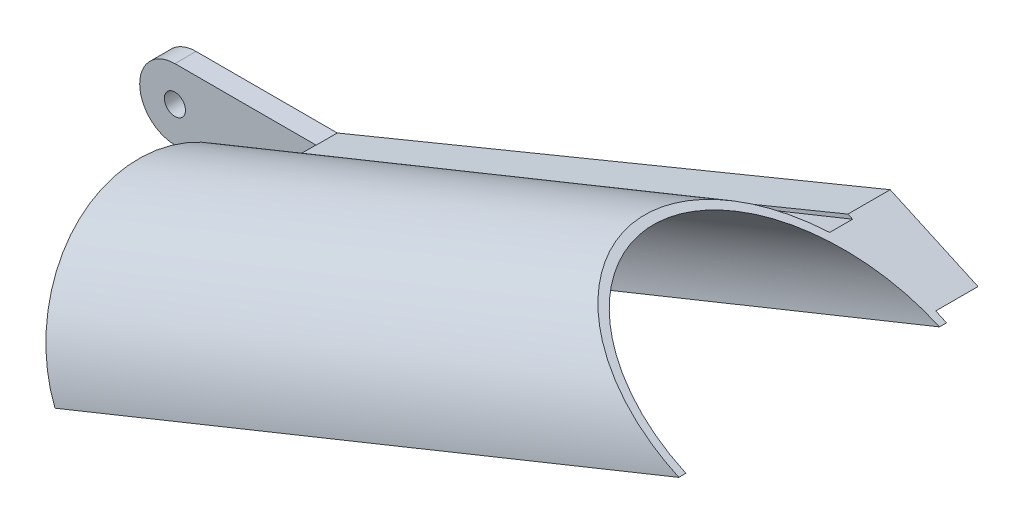
from build123d import *

# Parameters (mm, degrees)
SKETCH1_R           = 1.5
BOSS_EXTRUDE1_DEPTH = 3
EXTRUDE_1_DEPTH     = 3
EXTRUDE_3_DEPTH     = 3
EXTRUDE_4_REACH     = 98.931


with BuildPart() as part:
    # Sketch1 → Boss-Extrude1 (new body)
    # profile 1 of 2: a face of its own
    with BuildSketch(Plane.XY):
        with BuildLine():
            Line((20.05, 5), (0, 5))
            ThreePointArc((0, 5), (-5, 0), (0, -5))
            Line((0, -5), (22, -5))
            Line((22, -5), (25.516973514, -3.553997369))
            ThreePointArc((25.516973514, -3.553997369), (26.624391141, 1.901317064), (22, 5))
            Line((22, 5), (20.05, 5))
        make_face()
        Circle(SKETCH1_R, mode=Mode.SUBTRACT)
        with Locations((22, 0)):
            Circle(SKETCH1_R, mode=Mode.SUBTRACT)
    # profile 2 of 2: a face of its own
    with BuildSketch(Plane.XY):
        with BuildLine():
            Line((46.409029503, 15.837507263), (20.05, 5))
            Line((20.05, 5), (22, 5))
            ThreePointArc((22, 5), (26.624391141, 1.901317064), (25.516973514, -3.553997369))
            Line((25.516973514, -3.553997369), (48.359029503, 5.837507263))
            Line((48.359029503, 5.837507263), (58.872830999, 10.16025367))
            Line((58.872830999, 10.16025367), (53.359871826, 12.67140304))
            Line((53.359871826, 12.67140304), (46.409029503, 15.837507263))
        make_face()
    extrude(amount=BOSS_EXTRUDE1_DEPTH)

    # 草图1 → 凸台-拉伸1 (add)
    with BuildSketch(Plane.XY.offset(3)):
        Polygon((46.409029503, 15.837507263), (58.872830999, 10.16025367), (111.008388469, 31.59577286), (98.544586973, 37.273026453), align=None)
    extrude(amount=-EXTRUDE_1_DEPTH)

    # 草图17 → 凸台-拉伸3 (add)
    with BuildSketch(Plane.XY.offset(3)):
        with BuildLine():
            Line((111.008388469, 31.59577286), (23.732077121, -4.287856999))
            Line((23.732077121, -4.287856999), (22.936363323, -2.318021512))
            ThreePointArc((22.936363323, -2.318021512), (24.318021512, 0.936363323), (21.063636677, 2.318021512))
            Line((21.063636677, 2.318021512), (19.990187108, 4.975407947))
            Line((19.990187108, 4.975407947), (98.544586973, 37.273026453))
            Line((98.544586973, 37.273026453), (111.008388469, 31.59577286))
        make_face()
    extrude(amount=EXTRUDE_3_DEPTH)

    # 凸台-拉伸4: up to this plane
    extrude_4_end = Plane(origin=(98.544586973, 37.273026453, -70.058401543), z_dir=(0.4145222599320868, 0.9100391727946636, 0))
    # 草图18 → 凸台-拉伸4 (add, up to the surface)
    with BuildSketch(Plane(origin=(18.913747522, 7.640196343, 0), x_dir=(0.3745453290899799, -0.9272086046067943, 0), z_dir=(0.9272086046067944, 0.37454532908997995, 0)), mode=Mode.PRIVATE) as extrude_4_sk1:
        with BuildLine():
            Line((13.499999459, -6), (13.499999459, -7))
            ThreePointArc((13.499999459, -7), (-4.500000541, -25), (13.499999459, -43))
            Line((13.499999459, -43), (13.499999459, -44))
            ThreePointArc((13.499999459, -44), (-4.669553865, -30.55583765), (2.873990149, -9.249192842))
            Line((2.873990149, -9.249192842), (2.873990149, -6))
            Line((2.873990149, -6), (13.499999459, -6))
        make_face()
    extrude_4_tool1 = split(extrude(extrude_4_sk1.sketch, amount=EXTRUDE_4_REACH, mode=Mode.PRIVATE), bisect_by=extrude_4_end, keep=Keep.BOTH, mode=Mode.PRIVATE)
    add(extrude_4_tool1.solids().sort_by_distance((20.149314, 4.581481, 7.624596))[0])


solid = part.part
